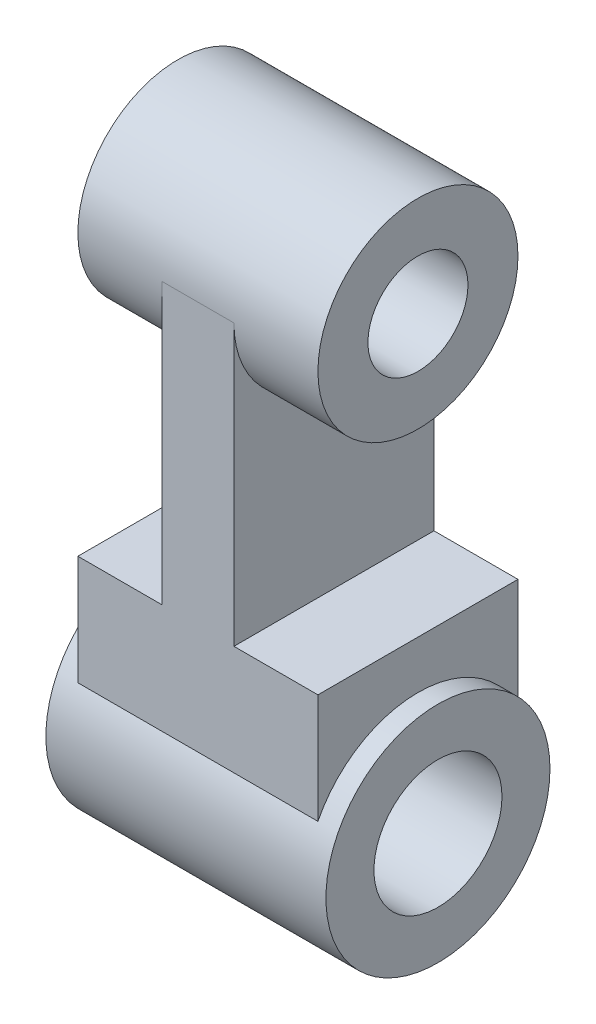
from build123d import *

# Parameters (mm, degrees)
SKETCH1_R           = 28
SKETCH1_R_2         = 16
BOSS_EXTRUDE1_DEPTH = 35
BOSS_EXTRUDE3_DEPTH = 30
BOSS_EXTRUDE4_DEPTH = 9
SKETCH5_R           = 25
SKETCH5_R_2         = 12.5
BOSS_EXTRUDE5_DEPTH = 30


with BuildPart() as part:
    # Sketch1 → Boss-Extrude1 (new, symmetric)
    with BuildSketch(Plane(origin=(0, 0, 0), x_dir=(0, 0, -1), z_dir=(1, 0, 0))):
        Circle(SKETCH1_R)
        Circle(SKETCH1_R_2, mode=Mode.SUBTRACT)
    extrude(amount=BOSS_EXTRUDE1_DEPTH, both=True)

    # Sketch2 → Boss-Extrude3 (add, symmetric)
    with BuildSketch(Plane(origin=(0, 0, 0), x_dir=(0, 0, -1), z_dir=(1, 0, 0))):
        with BuildLine():
            Line((-25, 40), (25, 40))
            Line((25, 40), (25, 12.609520213))
            ThreePointArc((25, 12.609520213), (0, 28), (-25, 12.609520213))
            Line((-25, 12.609520213), (-25, 40))
        make_face()
    extrude(amount=BOSS_EXTRUDE3_DEPTH, both=True)

    # Sketch3 → Boss-Extrude4 (add, symmetric)
    with BuildSketch(Plane(origin=(0, 0, 0), x_dir=(0, 0, -1), z_dir=(1, 0, 0))):
        with BuildLine():
            Line((-25, 40), (-25, 110))
            ThreePointArc((-25, 110), (0, 85), (25, 110))
            Line((25, 110), (25, 40))
            Line((25, 40), (-25, 40))
        make_face()
    extrude(amount=BOSS_EXTRUDE4_DEPTH, both=True)

    # Sketch5 → Boss-Extrude5 (add, symmetric)
    with BuildSketch(Plane(origin=(0, 0, 0), x_dir=(0, 0, -1), z_dir=(1, 0, 0))):
        with Locations((0, 110)):
            Circle(SKETCH5_R)
        with Locations((0, 110)):
            Circle(SKETCH5_R_2, mode=Mode.SUBTRACT)
    extrude(amount=BOSS_EXTRUDE5_DEPTH, both=True)


solid = part.part
